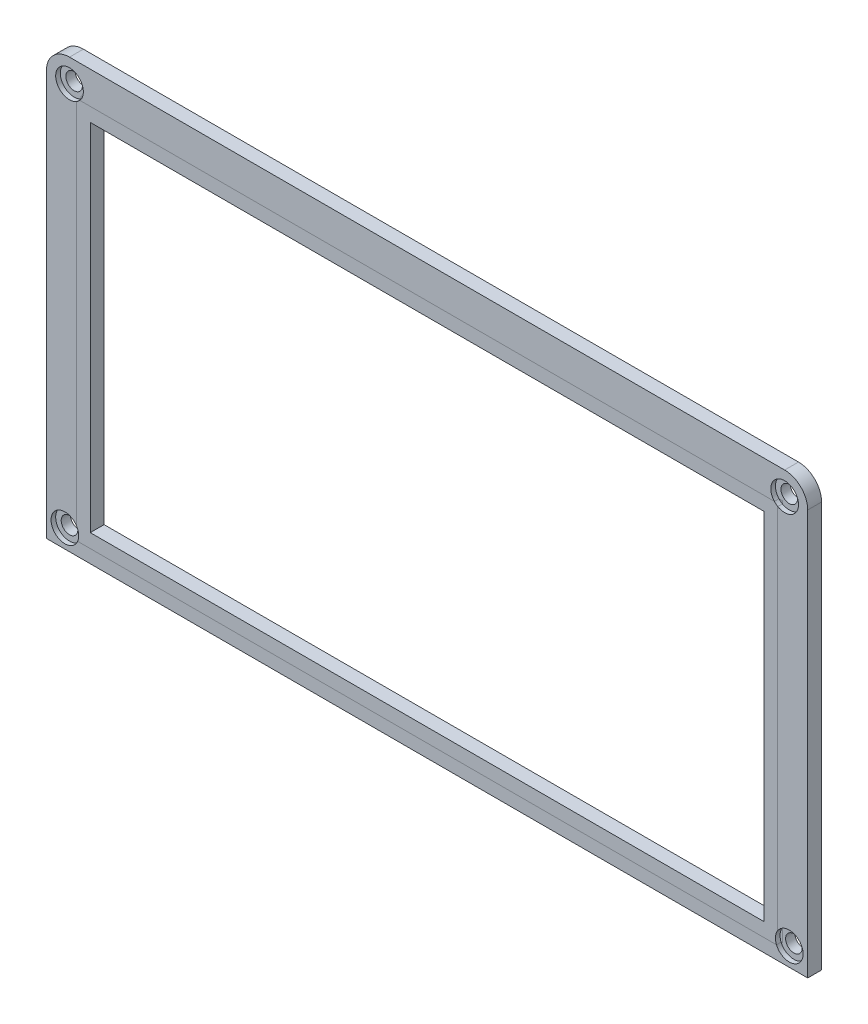
from build123d import *

# Parameters (mm, degrees)
SKETCH_2_W          = 152
SKETCH_2_H          = 83
EXTRUDE_1_DEPTH     = 3
SKETCH_3_W          = 152
SKETCH_3_H          = 83
SKETCH_3_W_2        = 146
SKETCH_3_H_2        = 77
EXTRUDE_2_DEPTH     = 3
SKETCH_4_R          = 1.8
CUT_EXTRUDE_1_DEPTH = 3
SKETCH_5_R          = 3
CUT_EXTRUDE_2_DEPTH = 1


with BuildPart() as part:
    # 草图2 → 凸台-拉伸1 (new body)
    with BuildSketch(Plane.XY):
        with BuildLine():
            Line((1.07069486, 13.575557044), (1.07069486, -65.621700899))
            Line((1.07069486, -65.621700899), (1.07069486, -74.272168286))
            Line((1.07069486, -74.272168286), (166.07069486, -74.272168286))
            Line((166.07069486, -74.272168286), (166.07069486, -65.621700899))
            Line((166.07069486, -65.621700899), (166.07069486, 13.575557044))
            ThreePointArc((166.07069486, 13.575557044), (164.606228766, 17.11109095), (161.07069486, 18.575557044))
            Line((161.07069486, 18.575557044), (6.07069486, 18.575557044))
            ThreePointArc((6.07069486, 18.575557044), (2.535160954, 17.11109095), (1.07069486, 13.575557044))
        make_face()
        with Locations((83.57069486, -29.924442956)):
            Rectangle(SKETCH_2_W, SKETCH_2_H, mode=Mode.SUBTRACT)
    extrude(amount=EXTRUDE_1_DEPTH)

    # 草图4 → 切除-拉伸1 (cut)
    with BuildSketch(Plane.XY.offset(3)):
        with Locations((6.07069486, 13.575557044)):
            Circle(SKETCH_4_R)
        with Locations((161.07069486, 13.575557044)):
            Circle(SKETCH_4_R)
        with Locations((5.07069486, -70.272168286)):
            Circle(SKETCH_4_R)
        with Locations((162.07069486, -70.272168286)):
            Circle(SKETCH_4_R)
    extrude(amount=-CUT_EXTRUDE_1_DEPTH, mode=Mode.SUBTRACT)


with BuildPart() as body_2:
    # 草图3 → 凸台-拉伸2 (new body)
    with BuildSketch(Plane.XY.offset(3)):
        with Locations((83.57069486, -29.924442956)):
            Rectangle(SKETCH_3_W, SKETCH_3_H)
        with Locations((83.57069486, -29.924442956)):
            Rectangle(SKETCH_3_W_2, SKETCH_3_H_2, mode=Mode.SUBTRACT)
    extrude(amount=-EXTRUDE_2_DEPTH)


with BuildPart() as cut_extrude_2_tool:
    # 草图5 → 切除-拉伸2 (new body)
    with BuildSketch(Plane.XY.offset(3)):
        with Locations((6.07069486, 13.575557044)):
            Circle(SKETCH_5_R)
        with Locations((161.07069486, 13.575557044)):
            Circle(SKETCH_5_R)
        with Locations((5.07069486, -70.272168286)):
            Circle(SKETCH_5_R)
        with Locations((162.07069486, -70.272168286)):
            Circle(SKETCH_5_R)
    extrude(amount=-CUT_EXTRUDE_2_DEPTH)


with BuildPart() as part_1:
    add(part.part)

    # 切除-拉伸2: cut by cut_extrude_2_tool
    add(cut_extrude_2_tool.part, mode=Mode.SUBTRACT)


with BuildPart() as body_2_1:
    add(body_2.part)

    # 切除-拉伸2: cut by cut_extrude_2_tool
    add(cut_extrude_2_tool.part, mode=Mode.SUBTRACT)


solid = Compound([part_1.part, body_2_1.part])
